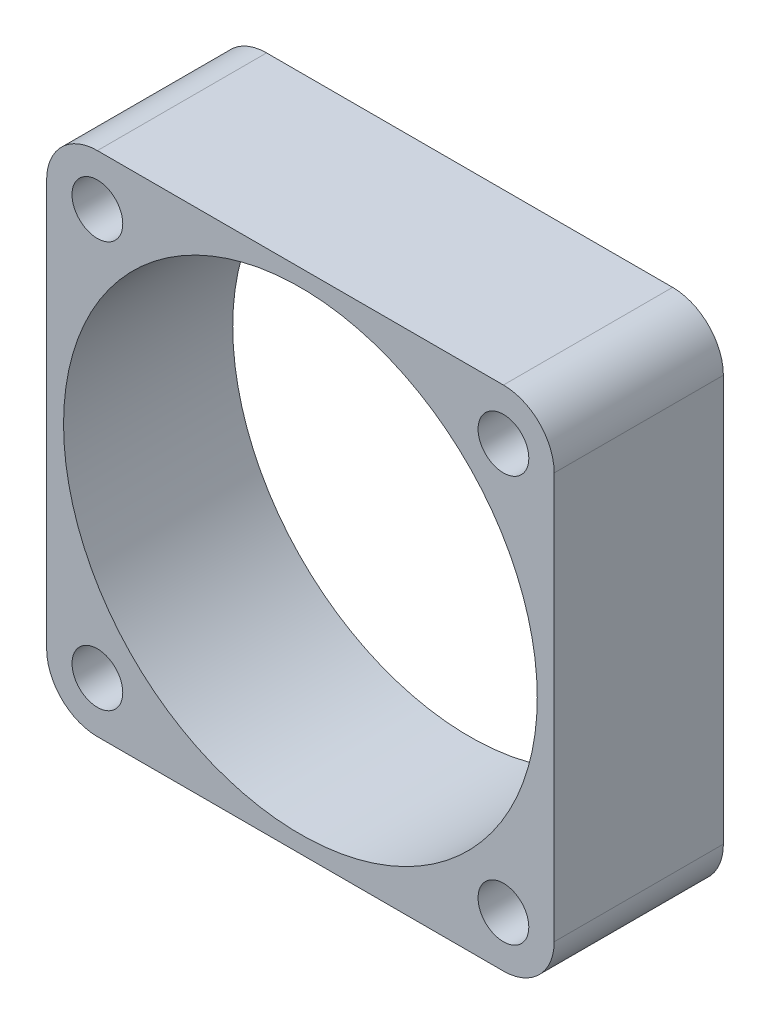
from build123d import *

# Parameters (mm, degrees)
SKETCH_1_W      = 30
SKETCH_1_H      = 30
SKETCH_1_R      = 14
SKETCH_1_R_2    = 1.5
EXTRUDE_1_DEPTH = 10
FILLET_1_R      = 3


with BuildPart() as part:
    # 草图1 → 凸台-拉伸1 (new body)
    with BuildSketch(Plane.XY):
        Rectangle(SKETCH_1_W, SKETCH_1_H)
        Circle(SKETCH_1_R, mode=Mode.SUBTRACT)
        with Locations((-12, 12)):
            Circle(SKETCH_1_R_2, mode=Mode.SUBTRACT)
        with Locations((12, 12)):
            Circle(SKETCH_1_R_2, mode=Mode.SUBTRACT)
        with Locations((12, -12)):
            Circle(SKETCH_1_R_2, mode=Mode.SUBTRACT)
        with Locations((-12, -12)):
            Circle(SKETCH_1_R_2, mode=Mode.SUBTRACT)
    extrude(amount=EXTRUDE_1_DEPTH)

    # 圆角1
    fillet_1_edges = [part.edges().sort_by_distance(p)[0] for p in [
        (-15, 15, 5),
        (15, 15, 5),
        (15, -15, 5),
        (-15, -15, 5),
    ]]
    fillet(fillet_1_edges, radius=FILLET_1_R)


solid = part.part
